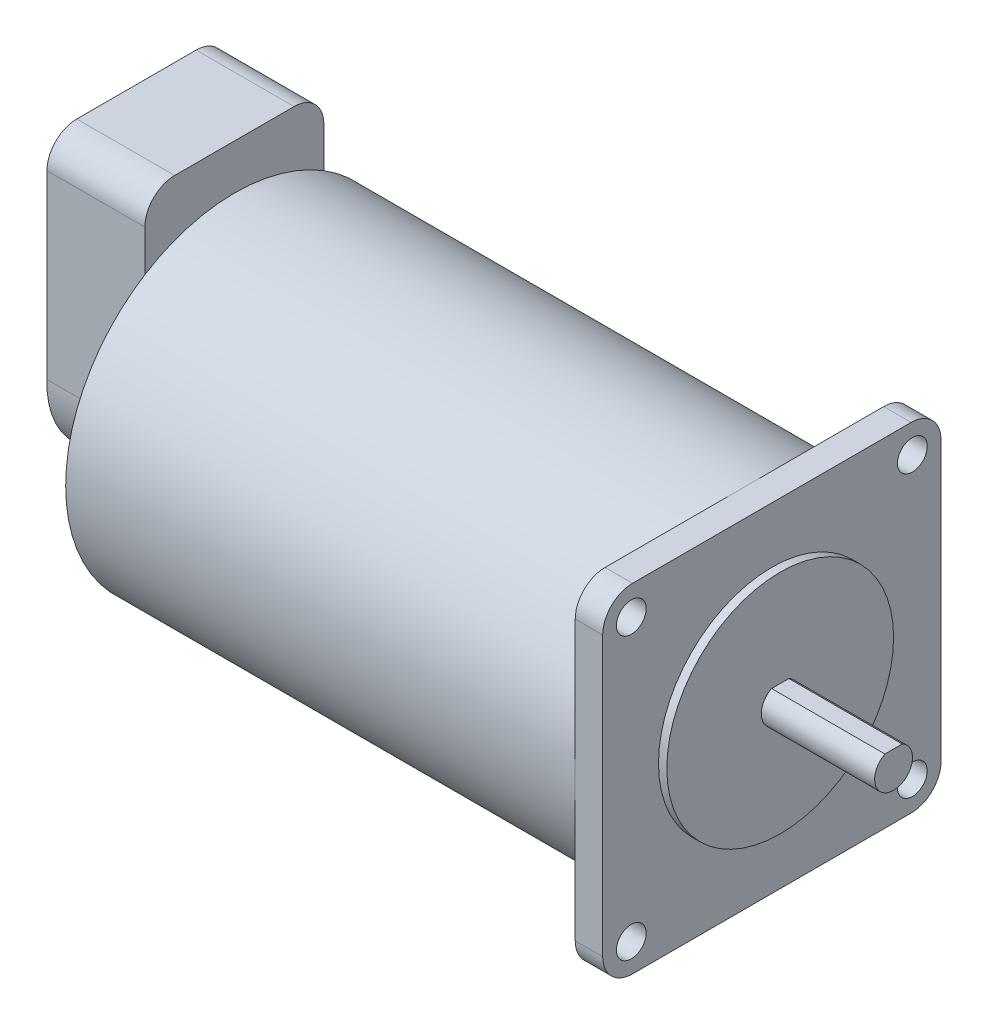
from build123d import *

# Parameters (mm, degrees)
SKETCH1_R           = 28.35
BOSS_EXTRUDE1_DEPTH = 85.4
SKETCH2_W           = 56.7
SKETCH2_H           = 56.7
SKETCH2_R           = 2.5
BOSS_EXTRUDE2_DEPTH = 4.6
SKETCH3_R           = 19
BOSS_EXTRUDE3_DEPTH = 1.4
BOSS_EXTRUDE4_DEPTH = 19
FILLET1_R           = 5
BOSS_EXTRUDE5_DEPTH = 16.4


with BuildPart() as part:
    # Sketch1 → Boss-Extrude1 (new body)
    with BuildSketch(Plane(origin=(0, 0, 0), x_dir=(0, 0, -1), z_dir=(1, 0, 0))):
        with Locations(Location((0, 0, 0), (0, 0, 180))):
            Circle(SKETCH1_R)
    extrude(amount=BOSS_EXTRUDE1_DEPTH)

    # Sketch2 → Boss-Extrude2 (add)
    with BuildSketch(Plane(origin=(85.4, 0, 0), x_dir=(0, 0, -1), z_dir=(1, 0, 0))):
        Rectangle(SKETCH2_W, SKETCH2_H)
        with Locations((-23.55, 23.55)):
            Circle(SKETCH2_R, mode=Mode.SUBTRACT)
        with Locations((23.55, 23.55)):
            Circle(SKETCH2_R, mode=Mode.SUBTRACT)
        with Locations((23.55, -23.55)):
            Circle(SKETCH2_R, mode=Mode.SUBTRACT)
        with Locations((-23.55, -23.55)):
            Circle(SKETCH2_R, mode=Mode.SUBTRACT)
    extrude(amount=BOSS_EXTRUDE2_DEPTH)

    # Sketch3 → Boss-Extrude3 (add)
    with BuildSketch(Plane(origin=(90, 0, 0), x_dir=(0, 0, -1), z_dir=(1, 0, 0))):
        Circle(SKETCH3_R)
    extrude(amount=BOSS_EXTRUDE3_DEPTH)

    # Sketch4 → Boss-Extrude4 (add)
    with BuildSketch(Plane(origin=(91.4, 0, 0), x_dir=(0, 0, -1), z_dir=(1, 0, 0))):
        with BuildLine():
            Line((-1.449137675, 2.825), (1.449137675, 2.825))
            ThreePointArc((1.449137675, 2.825), (0, -3.175), (-1.449137675, 2.825))
        make_face()
    extrude(amount=BOSS_EXTRUDE4_DEPTH)

    # Fillet1
    fillet1_edges = [part.edges().sort_by_distance(p)[0] for p in [
        (87.7, -28.35, 28.35),
        (87.7, -28.35, -28.35),
        (87.7, 28.35, -28.35),
        (87.7, 28.35, 28.35),
    ]]
    fillet(fillet1_edges, radius=FILLET1_R)

    # Sketch5 → Boss-Extrude5 (add)
    with BuildSketch(Plane.ZY):
        with BuildLine():
            Line((-14.919834855, -2.268447858), (-14.919834855, 30.908700262))
            ThreePointArc((-14.919834855, 30.908700262), (-13.455368761, 34.444234167), (-9.919834855, 35.908700262))
            Line((-9.919834855, 35.908700262), (10.080165145, 35.908700262))
            ThreePointArc((10.080165145, 35.908700262), (13.615699051, 34.444234167), (15.080165145, 30.908700262))
            Line((15.080165145, 30.908700262), (15.080165145, 0.579609357))
            ThreePointArc((15.080165145, 0.579609357), (1.426283256, -15.023749328), (-14.919834855, -2.268447858))
        make_face()
    extrude(amount=BOSS_EXTRUDE5_DEPTH)


solid = part.part
